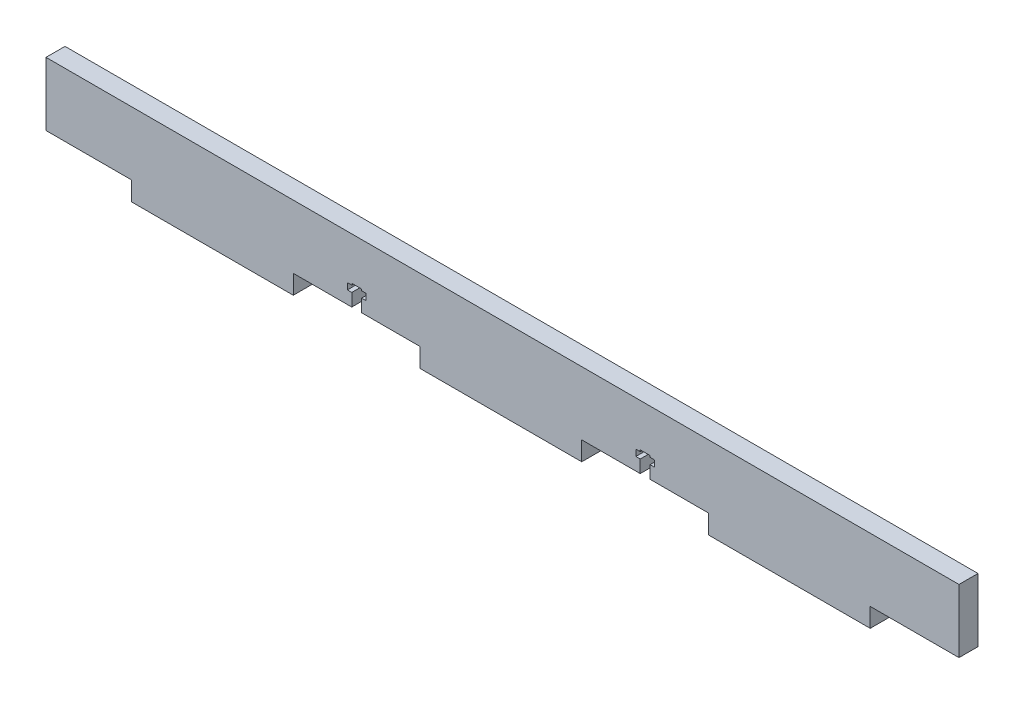
from build123d import *

# Parameters (mm, degrees)
SZKIC1_W                    = 288
SZKIC1_H                    = 26
DODANIE_WYCI_GNI_CIE1_DEPTH = 6
SZKIC5_W                    = 40
SZKIC5_H                    = 6
WYTNIJ_WYCI_GNI_CIE3_DEPTH  = 6
SZYK_LINIOWY1_COUNT         = 4
SZYK_LINIOWY1_PITCH         = 91
WYTNIJ_WYCI_GNI_CIE4_DEPTH  = 6
SZYK_LINIOWY2_COUNT         = 2
SZYK_LINIOWY2_PITCH         = 91


with BuildPart() as part:
    # Szkic1 → Dodanie-wyciągnięcie1 (new body)
    with BuildSketch(Plane.XY):
        with Locations((-735.9, 7)):
            Rectangle(SZKIC1_W, SZKIC1_H)
    extrude(amount=-DODANIE_WYCI_GNI_CIE1_DEPTH)

    # Szkic5 → Wytnij-wyciągnięcie3 (cut)
    with BuildSketch(Plane.XY):
        with Locations((-872.9, -3)):
            Rectangle(SZKIC5_W, SZKIC5_H)
    wytnij_wyci_gni_cie3 = extrude(amount=-WYTNIJ_WYCI_GNI_CIE3_DEPTH, mode=Mode.SUBTRACT)

    # Szyk liniowy1: Wytnij-wyciągnięcie3 ×4
    with Locations(*[(i * SZYK_LINIOWY1_PITCH, 0, 0) for i in range(1, SZYK_LINIOWY1_COUNT)]):
        add(wytnij_wyci_gni_cie3, mode=Mode.SUBTRACT)

    # Szkic6 → Wytnij-wyciągnięcie4 (cut)
    with BuildSketch(Plane.XY):
        Polygon((-780.35, 0), (-783.45, 0), (-783.45, 4), (-784.825, 4), (-784.825, 6), (-783.45, 6), (-783.45, 6.5), (-780.35, 6.5), (-780.35, 6), (-778.975, 6), (-778.975, 4), (-780.35, 4), align=None)
    wytnij_wyci_gni_cie4 = extrude(amount=-WYTNIJ_WYCI_GNI_CIE4_DEPTH, mode=Mode.SUBTRACT)

    # Szyk liniowy2: Wytnij-wyciągnięcie4 ×2
    with Locations(*[(i * SZYK_LINIOWY2_PITCH, 0, 0) for i in range(1, SZYK_LINIOWY2_COUNT)]):
        add(wytnij_wyci_gni_cie4, mode=Mode.SUBTRACT)


solid = part.part
